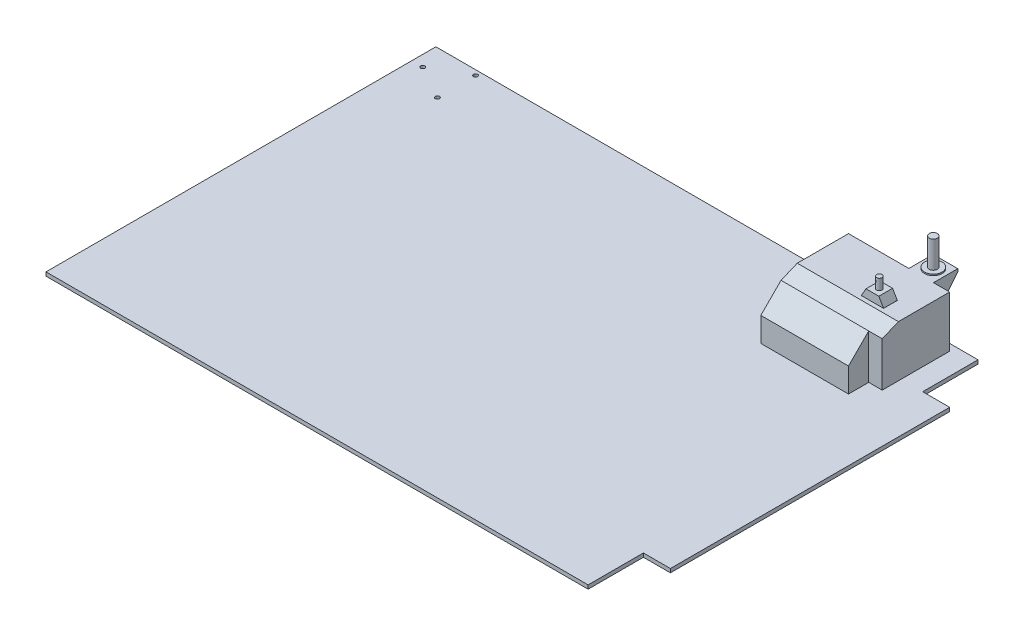
from build123d import *
from OCP.BRepFilletAPI import BRepFilletAPI_MakeChamfer

# Parameters (mm, degrees)
CROQUIS2_W              = 421.86
CROQUIS2_H              = 289
SALIENTE_EXTRUIR1_DEPTH = 2.8
CROQUIS3_W              = 20
CROQUIS3_H              = 41
CORTAR_EXTRUIR1_DEPTH   = 2.8
SALIENTE_EXTRUIR2_DEPTH = 38
CORTAR_EXTRUIR2_DEPTH   = 415.044477804
CORTAR_EXTRUIR3_DEPTH   = 405.741435487
CROQUIS7_W              = 16.492420957
CROQUIS7_H              = 10.17289517
SALIENTE_EXTRUIR3_DEPTH = 6.06
CHAFL_N1_SIZE           = 6
CHAFL_N1_SIZE2          = 3.5
CROQUIS9_R              = 1.995453572
SALIENTE_EXTRUIR4_DEPTH = 8
CROQUIS10_W             = 18.263552833
CROQUIS10_H             = 19
SALIENTE_EXTRUIR5_DEPTH = 18
CORTAR_EXTRUIR4_DEPTH   = 410.374118869
SALIENTE_EXTRUIR6_DEPTH = 1
CROQUIS13_R             = 3
SALIENTE_EXTRUIR7_DEPTH = 20
CROQUIS18_R             = 1.55
CORTAR_EXTRUIR5_DEPTH   = 10


with BuildPart() as part:
    # Croquis2 → Saliente-Extruir1 (new body)
    with BuildSketch(Plane(origin=(0, 0, 0), x_dir=(1, 0, 0), z_dir=(0, 1, 0))):
        Rectangle(CROQUIS2_W, CROQUIS2_H)
    extrude(amount=SALIENTE_EXTRUIR1_DEPTH)

    # Croquis3 → Cortar-Extruir1 (cut)
    with BuildSketch(Plane(origin=(0, 2.8, 0), x_dir=(1, 0, 0), z_dir=(0, 1, 0))):
        with Locations((200.93, -124)):
            Rectangle(CROQUIS3_W, CROQUIS3_H)
        with Locations((200.93, 124)):
            Rectangle(CROQUIS3_W, CROQUIS3_H)
    extrude(amount=-CORTAR_EXTRUIR1_DEPTH, mode=Mode.SUBTRACT)

    # Croquis4 → Saliente-Extruir2 (add)
    with BuildSketch(Plane(origin=(0, 2.8, 0), x_dir=(1, 0, 0), z_dir=(0, 1, 0))):
        Polygon((174.93, 139.5), (99.93, 139.5), (99.93, 89.5), (99.93, 74.5), (164.93, 74.5), (164.93, 89.5), (174.93, 89.5), align=None)
    extrude(amount=SALIENTE_EXTRUIR2_DEPTH)

    # Croquis5 → Cortar-Extruir2 (cut, through all)
    with BuildSketch(Plane(origin=(174.93, 0, 0), x_dir=(0, 0, -1), z_dir=(1, 0, 0))):
        Polygon((89.5, 35.8), (101.5, 40.8), (89.5, 40.8), align=None)
    extrude(amount=-CORTAR_EXTRUIR2_DEPTH, mode=Mode.SUBTRACT)

    # Croquis6 → Cortar-Extruir3 (cut, through all)
    with BuildSketch(Plane(origin=(164.93, 0, 0), x_dir=(0, 0, -1), z_dir=(1, 0, 0))):
        Polygon((74.5, 35.8), (74.5, 20.8), (89.5, 35.8), (89.5, 40.8), (74.5, 40.8), align=None)
    extrude(amount=-CORTAR_EXTRUIR3_DEPTH, mode=Mode.SUBTRACT)

    # Croquis7 → Saliente-Extruir3 (add)
    with BuildSketch(Plane(origin=(0, 40.8, 0), x_dir=(1, 0, 0), z_dir=(0, 1, 0))):
        with Locations((152.683789521, 109.586447585)):
            Rectangle(CROQUIS7_W, CROQUIS7_H)
    extrude(amount=SALIENTE_EXTRUIR3_DEPTH)

    # Chaflán1: one chamfer whose edges measure the first distance from different faces: ONE call of the kernel's chamfer builder (chamfer() names one face for all edges)
    chafl_n1_edges_1 = [part.edges().sort_by_distance(p)[0] for p in [
        (160.93, 46.86, -109.586447585),
    ]]
    chafl_n1_side_1 = [part.faces().sort_by_distance(p)[0] for p in [
        (160.93, 43.83, -109.586447585),
    ]]
    chafl_n1_edges_2 = [part.edges().sort_by_distance(p)[0] for p in [
        (144.437579043, 46.86, -109.586447585),
    ]]
    chafl_n1_side_2 = [part.faces().sort_by_distance(p)[0] for p in [
        (144.437579043, 43.83, -109.586447585),
    ]]
    chafl_n1 = BRepFilletAPI_MakeChamfer(part.part.solid().wrapped)
    for e in chafl_n1_edges_1:
        chafl_n1.Add(CHAFL_N1_SIZE, CHAFL_N1_SIZE2, e.wrapped, chafl_n1_side_1[0].wrapped)  # the first distance lies on this face
    for e in chafl_n1_edges_2:
        chafl_n1.Add(CHAFL_N1_SIZE, CHAFL_N1_SIZE2, e.wrapped, chafl_n1_side_2[0].wrapped)  # the first distance lies on this face
    add(Compound.cast(chafl_n1.Shape()), mode=Mode.REPLACE)

    # Croquis9 → Saliente-Extruir4 (add)
    with BuildSketch(Plane(origin=(0, 46.86, 0), x_dir=(1, 0, 0), z_dir=(0, 1, 0))):
        with Locations(Location((152.683789521, 109.586447585, 0), (0, 0, 270))):
            Circle(CROQUIS9_R)
    extrude(amount=SALIENTE_EXTRUIR4_DEPTH)

    # Croquis10 → Saliente-Extruir5 (add)
    with BuildSketch(Plane(origin=(0, 0, -139.5), x_dir=(-1, 0, 0), z_dir=(0, 0, -1))):
        with Locations((-153.798223584, 31.3)):
            Rectangle(CROQUIS10_W, CROQUIS10_H)
    extrude(amount=SALIENTE_EXTRUIR5_DEPTH)

    # Croquis11 → Cortar-Extruir4 (cut, through all)
    with BuildSketch(Plane(origin=(162.93, 0, 0), x_dir=(0, 0, -1), z_dir=(1, 0, 0))):
        Polygon((157.5, 38.8), (143.909536757, 21.8), (157.5, 21.8), align=None)
    extrude(amount=-CORTAR_EXTRUIR4_DEPTH, mode=Mode.SUBTRACT)

    # Croquis12 → Saliente-Extruir6 (add)
    with BuildSketch(Plane(origin=(0, 40.8, 0), x_dir=(1, 0, 0), z_dir=(0, 1, 0))):
        with BuildLine():
            ThreePointArc((160.298223583, 148.5), (156.263827828, 154.514216134), (149.168747981, 153.062669794))
            Line((149.168747981, 153.062669794), (158.427699186, 143.937330206))
            ThreePointArc((158.427699186, 143.937330206), (159.812439717, 146.034395755), (160.298223583, 148.5))
        make_face()
        with BuildLine():
            Line((158.427699186, 143.937330206), (149.168747981, 153.062669794))
            ThreePointArc((149.168747981, 153.062669794), (149.23555379, 143.870524398), (158.427699186, 143.937330206))
        make_face()
    extrude(amount=SALIENTE_EXTRUIR6_DEPTH)

    # Croquis13 → Saliente-Extruir7 (add)
    with BuildSketch(Plane(origin=(0, 41.8, 0), x_dir=(1, 0, 0), z_dir=(0, 1, 0))):
        with Locations(Location((153.798223583, 148.5, 0), (0, 0, 270))):
            Circle(CROQUIS13_R)
    extrude(amount=SALIENTE_EXTRUIR7_DEPTH)

    # Croquis18 → Cortar-Extruir5 (cut)
    with BuildSketch(Plane(origin=(0, 2.8, 0), x_dir=(1, 0, 0), z_dir=(0, 1, 0))):
        with Locations(Location((-177.78113513, 112.490742036, 0), (0, 0, 270))):
            Circle(CROQUIS18_R)
        with Locations(Location((-177.78113513, 140.790742036, 0), (0, 0, 270))):
            Circle(CROQUIS18_R)
        with Locations(Location((-202.78113513, 126.640742036, 0), (0, 0, 270))):
            Circle(CROQUIS18_R)
    extrude(amount=-CORTAR_EXTRUIR5_DEPTH, mode=Mode.SUBTRACT)


solid = part.part
